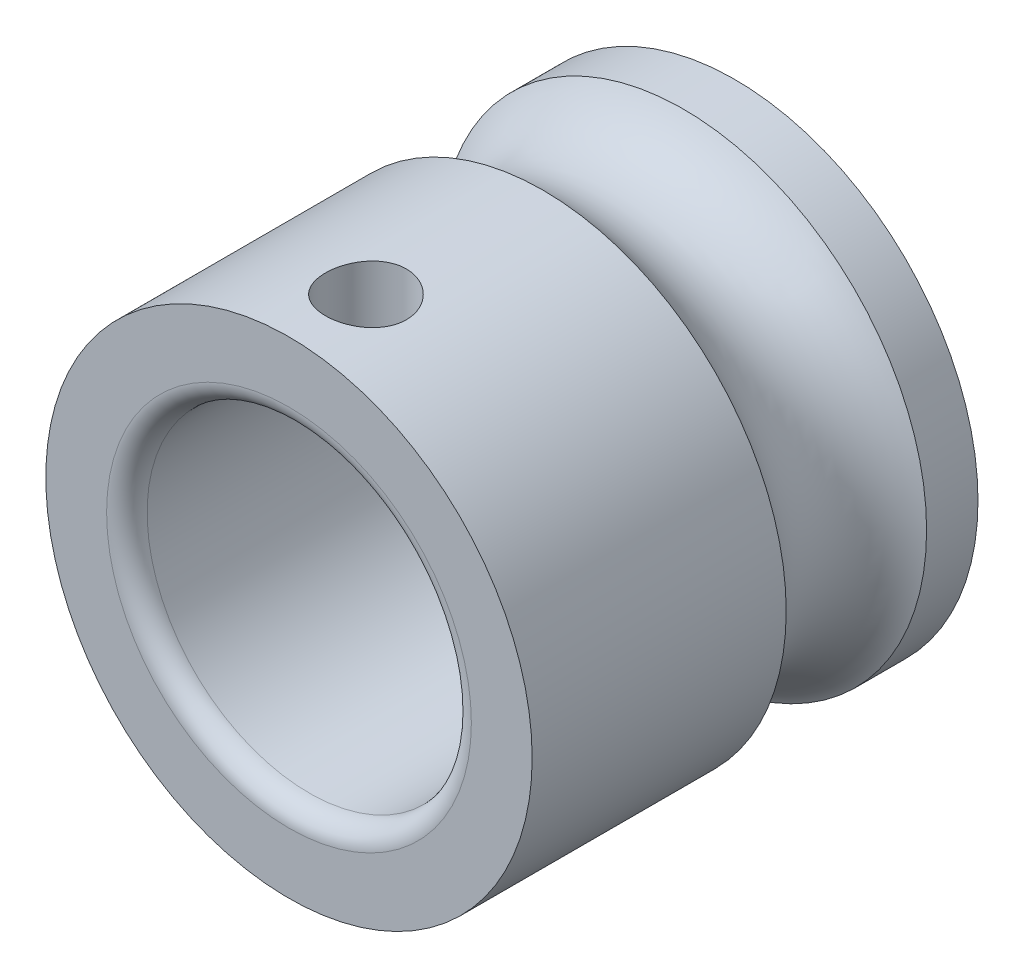
from build123d import *

# Parameters (mm, degrees)
BOSS_EXTRUDE1_DEPTH      = 8
BOSS_EXTRUDE1_DEPTH_BACK = 3
SKETCH1_R                = 6
SKETCH1_R_2              = 4
SKETCH3_R                = 2
FILLET1_R                = 0.5
SKETCH4_R                = 1
CUT_EXTRUDE2_DEPTH       = 12.66190379


with BuildPart() as part:
    # Sketch1 → Boss-Extrude1 (new, two sides: drawn at the far end of the back side and taken through both)
    with BuildSketch(Plane.XY.offset(-BOSS_EXTRUDE1_DEPTH_BACK)):
        Circle(SKETCH1_R)
        Circle(SKETCH1_R_2, mode=Mode.SUBTRACT)
    extrude(amount=BOSS_EXTRUDE1_DEPTH + BOSS_EXTRUDE1_DEPTH_BACK)

    # Sketch3 → Cut-Revolve1 (revolve, cut)
    with BuildSketch(Plane(origin=(0, 0, 0), x_dir=(1, 0, 0), z_dir=(0, 1, 0)), mode=Mode.PRIVATE) as cut_revolve1_sk:
        with Locations((-7, 0)):
            Circle(SKETCH3_R)
    revolve(cut_revolve1_sk.sketch.rotate(Axis((0, 0, -3.036308444), (0, 0, 1)), 180), axis=Axis((0, 0, -3.036308444), (0, 0, 1)), mode=Mode.SUBTRACT)

    # Fillet1
    fillet1_edges = [part.edges().sort_by_distance(p)[0] for p in [
        (-4, 0, -3),
        (-4, 0, 8),
    ]]
    fillet(fillet1_edges, radius=FILLET1_R)

    # Sketch4 → Cut-Extrude2 (cut, through all)
    with BuildSketch(Plane(origin=(0, 0, 0), x_dir=(1, 0, 0), z_dir=(0, 1, 0))):
        with Locations(Location((0, -6.101025888, 0), (0, 0, 90))):
            Circle(SKETCH4_R)
    extrude(amount=CUT_EXTRUDE2_DEPTH, mode=Mode.SUBTRACT)


solid = part.part
